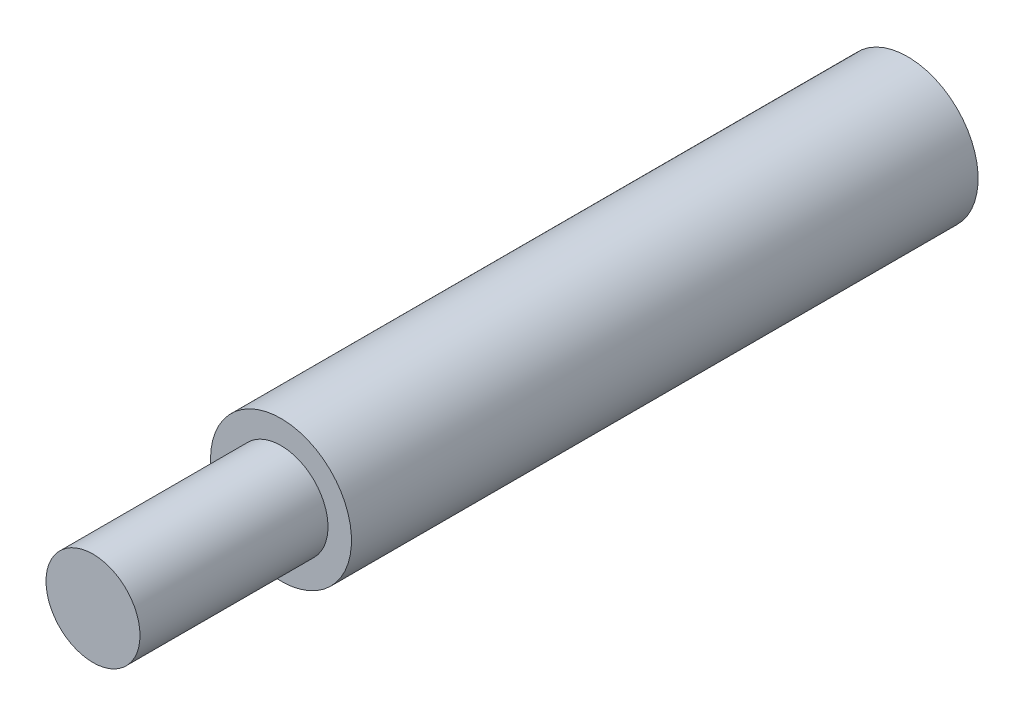
from build123d import *

# Parameters (mm, degrees)
SKETCH1_R           = 1.5
BOSS_EXTRUDE1_DEPTH = 6
SKETCH2_R           = 2.25
BOSS_EXTRUDE2_DEPTH = 20
SKETCH3_R           = 1.5
CUT_EXTRUDE1_DEPTH  = 4.5


with BuildPart() as part:
    # Sketch1 → Boss-Extrude1 (new body)
    with BuildSketch(Plane.XY):
        Circle(SKETCH1_R)
    extrude(amount=BOSS_EXTRUDE1_DEPTH)

    # Sketch2 → Boss-Extrude2 (add)
    with BuildSketch(Plane(origin=(0, 0, 0), x_dir=(-1, 0, 0), z_dir=(0, 0, -1))):
        Circle(SKETCH2_R)
    extrude(amount=BOSS_EXTRUDE2_DEPTH)

    # Sketch3 → Cut-Extrude1 (cut)
    with BuildSketch(Plane(origin=(0, 0, -20), x_dir=(-1, 0, 0), z_dir=(0, 0, -1))):
        Circle(SKETCH3_R)
    extrude(amount=-CUT_EXTRUDE1_DEPTH, mode=Mode.SUBTRACT)


solid = part.part
